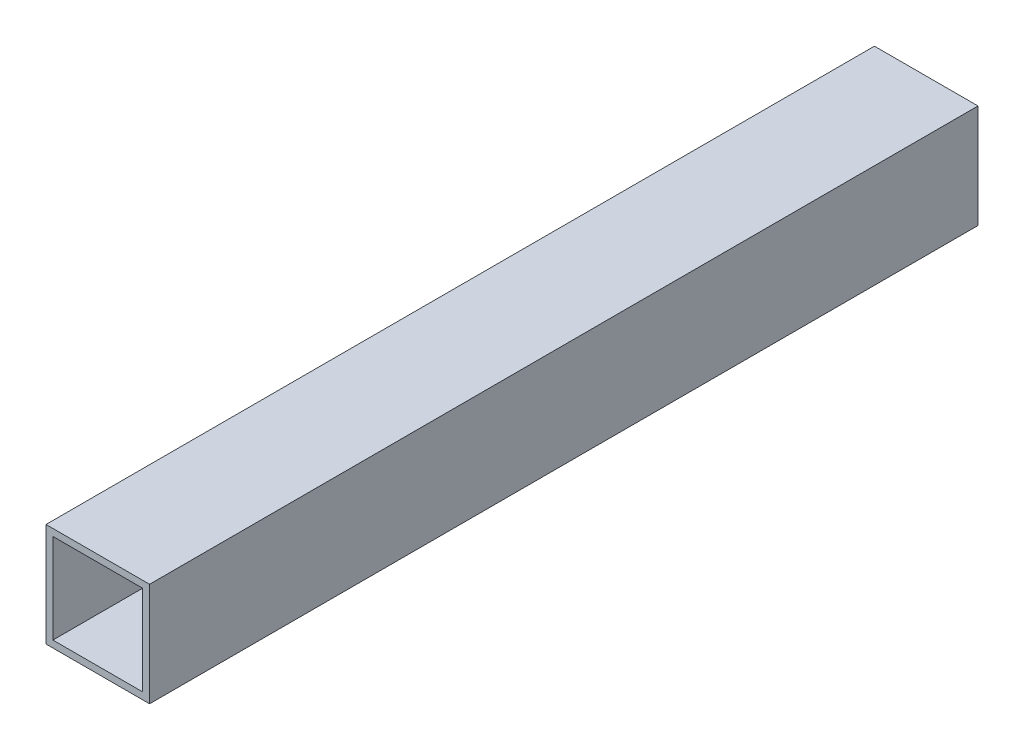
from build123d import *

# Parameters (mm, degrees)
SKETCH1_W           = 30
SKETCH1_H           = 30
SKETCH1_W_2         = 26
SKETCH1_H_2         = 26
BOSS_EXTRUDE1_DEPTH = 240


with BuildPart() as part:
    # Sketch1 → Boss-Extrude1 (new body)
    with BuildSketch(Plane.XY):
        Rectangle(SKETCH1_W, SKETCH1_H)
        Rectangle(SKETCH1_W_2, SKETCH1_H_2, mode=Mode.SUBTRACT)
    extrude(amount=BOSS_EXTRUDE1_DEPTH)


solid = part.part
